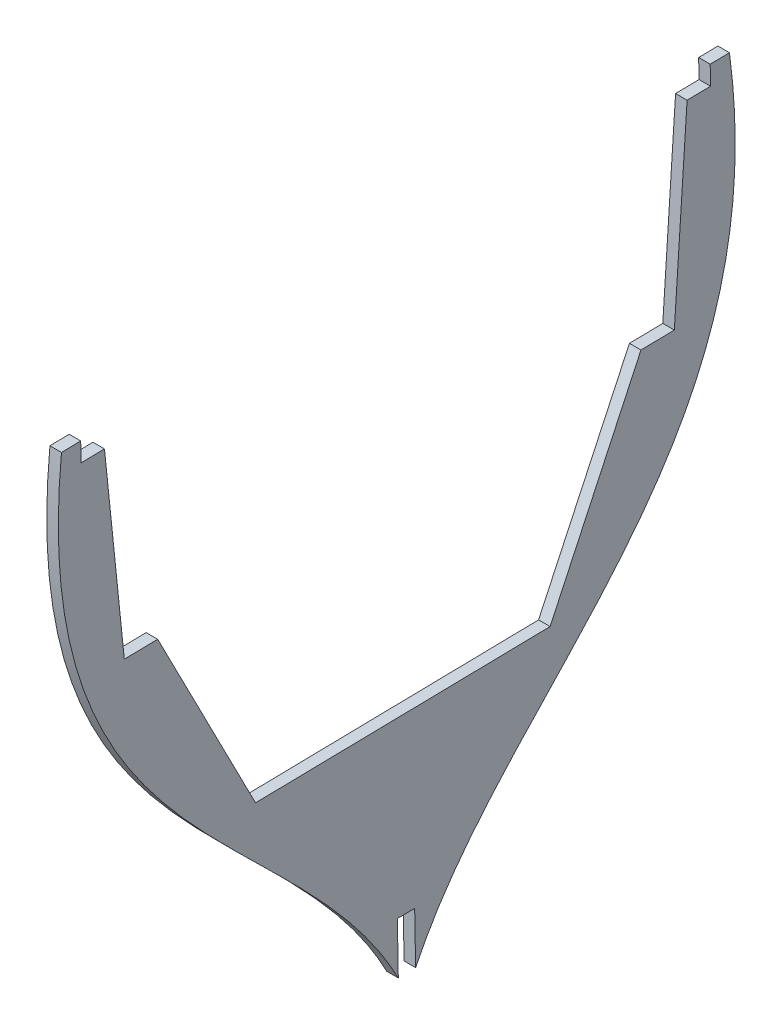
from build123d import *

# Parameters (mm, degrees)
BOSS_EXTRU_3_DEPTH      = 6
ENL_V_MAT_EXTRU_1_DEPTH = 6


with BuildPart() as part:
    # Esquisse2 → Boss.-Extru.3 (new body)
    with BuildSketch(Plane(origin=(0, 0, 0), x_dir=(0, 0, -1), z_dir=(1, 0, 0))):
        with BuildLine():
            Line((167.067104912, 360.877811952), (157.068777156, 360.694940166))
            Line((157.068777156, 360.694940166), (157.251648942, 350.696612411))
            Line((157.251648942, 350.696612411), (145.068912969, 350.473787281))
            Line((145.068912969, 350.473787281), (138.417902672, 250.335413485))
            Line((138.417902672, 250.335413485), (121.08474079, 250.018385844))
            Line((121.08474079, 250.018385844), (73.851957421, 149.137761795))
            Line((73.851957421, 149.137761795), (-79.256267761, 146.337376049))
            Line((-79.256267761, 146.337376049), (-130.146486842, 245.423307114))
            Line((-130.146486842, 245.423307114), (-147.479648725, 245.106279473))
            Line((-147.479648725, 245.106279473), (-157.788094735, 344.934460791))
            Line((-157.788094735, 344.934460791), (-169.970830707, 344.711635661))
            Line((-169.970830707, 344.711635661), (-170.153702493, 354.709963417))
            Line((-170.153702493, 354.709963417), (-180.152030248, 354.527091631))
            add(Edge.make_bspline(
                [(-180.152030248, 354.527091631), (-198.992254162, 163.680816755), (-49.950329985, 130.264512108), (-0.380736229, 20.816363718)],
                knots=[0, 0, 0, 0, 1, 1, 1, 1], degree=3))
            add(Edge.make_bspline(
                [(167.067104912, 360.877811952), (192.87364027, 170.848136891), (45.153377044, 132.003981462), (-0.380736229, 20.816363718)],
                knots=[0, 0, 0, 0, 1, 1, 1, 1], degree=3))
        make_face()
    extrude(amount=BOSS_EXTRU_3_DEPTH)

    # Esquisse3 → Enlèv. mat.-Extru.1 (cut)
    with BuildSketch(Plane(origin=(6, 0, 0), x_dir=(0, 0, -1), z_dir=(1, 0, 0))):
        Polygon((-5.056380315, 30.378374814), (-5.550134136, 57.373859755), (3.448360844, 57.538444362), (3.942114665, 30.542959421), (18.308003546, 10.935985813), (-13.114984321, 12.641103372), align=None)
    extrude(amount=-ENL_V_MAT_EXTRU_1_DEPTH, mode=Mode.SUBTRACT)


solid = part.part
